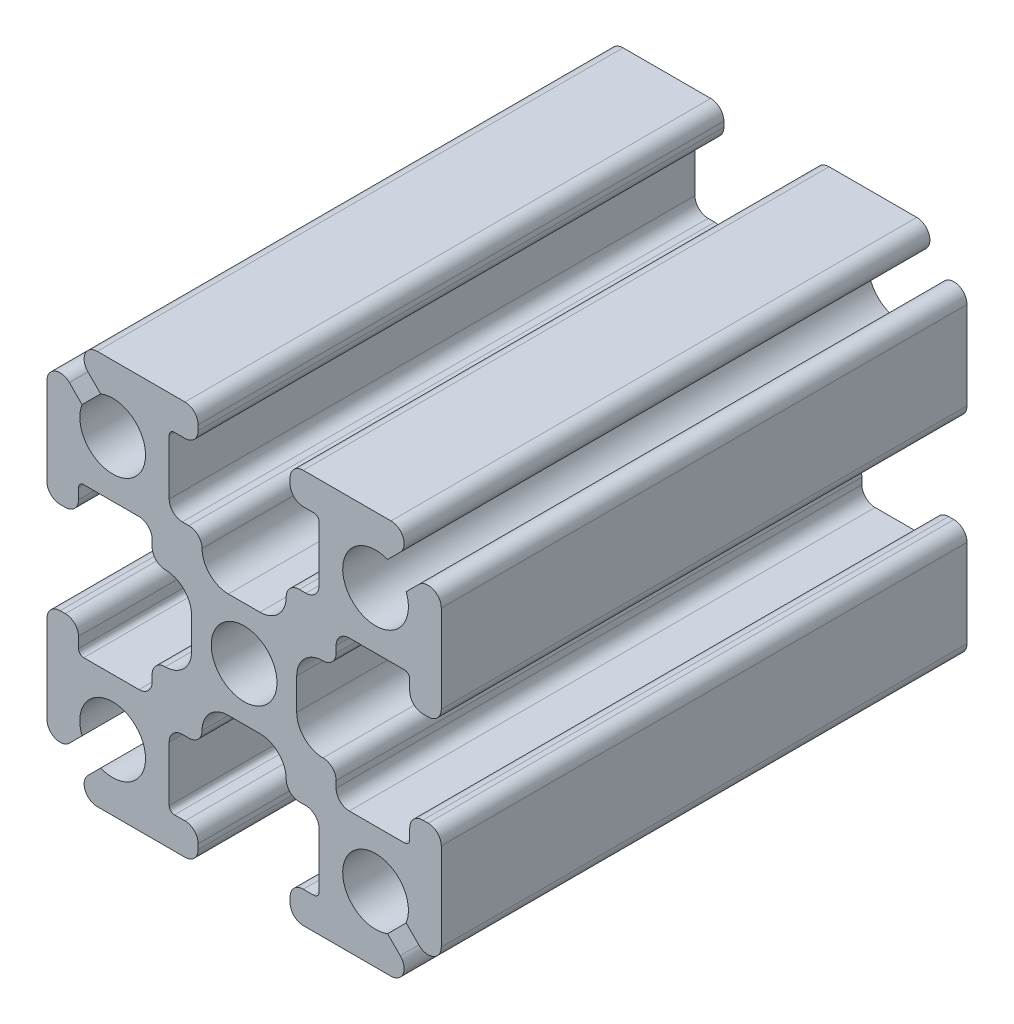
from build123d import *

# Parameters (mm, degrees)
SKETCH1_R           = 1.25
BOSS_EXTRUDE1_DEPTH = 20


with BuildPart() as part:
    # Sketch1 → Boss-Extrude1 (new body)
    with BuildSketch(Plane.XY):
        with BuildLine():
            Line((6.646446609, 5.939339828), (6.163645978, 5.456539197))
            ThreePointArc((6.163645978, 5.456539197), (4.116116524, 4.116116524), (5.456539197, 6.163645978))
            Line((5.456539197, 6.163645978), (5.939339828, 6.646446609))
            ThreePointArc((5.939339828, 6.646446609), (6.047726204, 7.191341716), (5.585786438, 7.5))
            Line((5.585786438, 7.5), (2.25, 7.5))
            ThreePointArc((2.25, 7.5), (1.896446609, 7.353553391), (1.75, 7))
            Line((1.75, 7), (1.75, 6.8))
            ThreePointArc((1.75, 6.8), (1.896446609, 6.446446609), (2.25, 6.3))
            Line((2.25, 6.3), (2.65, 6.3))
            ThreePointArc((2.65, 6.3), (2.791421356, 6.241421356), (2.85, 6.1))
            Line((2.85, 6.1), (2.85, 4))
            ThreePointArc((2.85, 4), (2.703553391, 3.646446609), (2.35, 3.5))
            Line((2.35, 3.5), (2.1, 3.5))
            ThreePointArc((2.1, 3.5), (1.746446609, 3.353553391), (1.6, 3))
            ThreePointArc((1.6, 3), (1.307106781, 2.292893219), (0.6, 2))
            Line((0.6, 2), (-0.6, 2))
            ThreePointArc((-0.6, 2), (-1.307106781, 2.292893219), (-1.6, 3))
            ThreePointArc((-1.6, 3), (-1.746446609, 3.353553391), (-2.1, 3.5))
            Line((-2.1, 3.5), (-2.35, 3.5))
            ThreePointArc((-2.35, 3.5), (-2.703553391, 3.646446609), (-2.85, 4))
            Line((-2.85, 4), (-2.85, 6.1))
            ThreePointArc((-2.85, 6.1), (-2.791421356, 6.241421356), (-2.65, 6.3))
            Line((-2.65, 6.3), (-2.25, 6.3))
            ThreePointArc((-2.25, 6.3), (-1.896446609, 6.446446609), (-1.75, 6.8))
            Line((-1.75, 6.8), (-1.75, 7))
            ThreePointArc((-1.75, 7), (-1.896446609, 7.353553391), (-2.25, 7.5))
            Line((-2.25, 7.5), (-5.585786438, 7.5))
            ThreePointArc((-5.585786438, 7.5), (-6.047726204, 7.191341716), (-5.939339828, 6.646446609))
            Line((-5.939339828, 6.646446609), (-5.456539197, 6.163645978))
            ThreePointArc((-5.456539197, 6.163645978), (-4.116116524, 4.116116524), (-6.163645978, 5.456539197))
            Line((-6.163645978, 5.456539197), (-6.646446609, 5.939339828))
            ThreePointArc((-6.646446609, 5.939339828), (-7.191341716, 6.047726204), (-7.5, 5.585786438))
            Line((-7.5, 5.585786438), (-7.5, 2.25))
            ThreePointArc((-7.5, 2.25), (-7.353553391, 1.896446609), (-7, 1.75))
            Line((-7, 1.75), (-6.8, 1.75))
            ThreePointArc((-6.8, 1.75), (-6.446446609, 1.896446609), (-6.3, 2.25))
            Line((-6.3, 2.25), (-6.3, 2.65))
            ThreePointArc((-6.3, 2.65), (-6.241421356, 2.791421356), (-6.1, 2.85))
            Line((-6.1, 2.85), (-4, 2.85))
            ThreePointArc((-4, 2.85), (-3.646446609, 2.703553391), (-3.5, 2.35))
            Line((-3.5, 2.35), (-3.5, 2.1))
            ThreePointArc((-3.5, 2.1), (-3.353553391, 1.746446609), (-3, 1.6))
            ThreePointArc((-3, 1.6), (-2.292893219, 1.307106781), (-2, 0.6))
            Line((-2, 0.6), (-2, -0.6))
            ThreePointArc((-2, -0.6), (-2.292893219, -1.307106781), (-3, -1.6))
            ThreePointArc((-3, -1.6), (-3.353553391, -1.746446609), (-3.5, -2.1))
            Line((-3.5, -2.1), (-3.5, -2.35))
            ThreePointArc((-3.5, -2.35), (-3.646446609, -2.703553391), (-4, -2.85))
            Line((-4, -2.85), (-6.1, -2.85))
            ThreePointArc((-6.1, -2.85), (-6.241421356, -2.791421356), (-6.3, -2.65))
            Line((-6.3, -2.65), (-6.3, -2.25))
            ThreePointArc((-6.3, -2.25), (-6.446446609, -1.896446609), (-6.8, -1.75))
            Line((-6.8, -1.75), (-7, -1.75))
            ThreePointArc((-7, -1.75), (-7.353553391, -1.896446609), (-7.5, -2.25))
            Line((-7.5, -2.25), (-7.5, -5.585786438))
            ThreePointArc((-7.5, -5.585786438), (-7.191341716, -6.047726204), (-6.646446609, -5.939339828))
            Line((-6.646446609, -5.939339828), (-6.163645978, -5.456539197))
            ThreePointArc((-6.163645978, -5.456539197), (-4.116116524, -4.116116524), (-5.456539197, -6.163645978))
            Line((-5.456539197, -6.163645978), (-5.939339828, -6.646446609))
            ThreePointArc((-5.939339828, -6.646446609), (-6.047726204, -7.191341716), (-5.585786438, -7.5))
            Line((-5.585786438, -7.5), (-2.25, -7.5))
            ThreePointArc((-2.25, -7.5), (-1.896446609, -7.353553391), (-1.75, -7))
            Line((-1.75, -7), (-1.75, -6.8))
            ThreePointArc((-1.75, -6.8), (-1.896446609, -6.446446609), (-2.25, -6.3))
            Line((-2.25, -6.3), (-2.65, -6.3))
            ThreePointArc((-2.65, -6.3), (-2.791421356, -6.241421356), (-2.85, -6.1))
            Line((-2.85, -6.1), (-2.85, -4))
            ThreePointArc((-2.85, -4), (-2.703553391, -3.646446609), (-2.35, -3.5))
            Line((-2.35, -3.5), (-2.1, -3.5))
            ThreePointArc((-2.1, -3.5), (-1.746446609, -3.353553391), (-1.6, -3))
            ThreePointArc((-1.6, -3), (-1.307106781, -2.292893219), (-0.6, -2))
            Line((-0.6, -2), (0.6, -2))
            ThreePointArc((0.6, -2), (1.307106781, -2.292893219), (1.6, -3))
            ThreePointArc((1.6, -3), (1.746446609, -3.353553391), (2.1, -3.5))
            Line((2.1, -3.5), (2.35, -3.5))
            ThreePointArc((2.35, -3.5), (2.703553391, -3.646446609), (2.85, -4))
            Line((2.85, -4), (2.85, -6.1))
            ThreePointArc((2.85, -6.1), (2.791421356, -6.241421356), (2.65, -6.3))
            Line((2.65, -6.3), (2.25, -6.3))
            ThreePointArc((2.25, -6.3), (1.896446609, -6.446446609), (1.75, -6.8))
            Line((1.75, -6.8), (1.75, -7))
            ThreePointArc((1.75, -7), (1.896446609, -7.353553391), (2.25, -7.5))
            Line((2.25, -7.5), (5.585786438, -7.5))
            ThreePointArc((5.585786438, -7.5), (6.047726204, -7.191341716), (5.939339828, -6.646446609))
            Line((5.939339828, -6.646446609), (5.456539197, -6.163645978))
            ThreePointArc((5.456539197, -6.163645978), (4.116116524, -4.116116524), (6.163645978, -5.456539197))
            Line((6.163645978, -5.456539197), (6.646446609, -5.939339828))
            ThreePointArc((6.646446609, -5.939339828), (7.191341716, -6.047726204), (7.5, -5.585786438))
            Line((7.5, -5.585786438), (7.5, -2.25))
            ThreePointArc((7.5, -2.25), (7.353553391, -1.896446609), (7, -1.75))
            Line((7, -1.75), (6.8, -1.75))
            ThreePointArc((6.8, -1.75), (6.446446609, -1.896446609), (6.3, -2.25))
            Line((6.3, -2.25), (6.3, -2.65))
            ThreePointArc((6.3, -2.65), (6.241421356, -2.791421356), (6.1, -2.85))
            Line((6.1, -2.85), (4, -2.85))
            ThreePointArc((4, -2.85), (3.646446609, -2.703553391), (3.5, -2.35))
            Line((3.5, -2.35), (3.5, -2.1))
            ThreePointArc((3.5, -2.1), (3.353553391, -1.746446609), (3, -1.6))
            ThreePointArc((3, -1.6), (2.292893219, -1.307106781), (2, -0.6))
            Line((2, -0.6), (2, 0.6))
            ThreePointArc((2, 0.6), (2.292893219, 1.307106781), (3, 1.6))
            ThreePointArc((3, 1.6), (3.353553391, 1.746446609), (3.5, 2.1))
            Line((3.5, 2.1), (3.5, 2.35))
            ThreePointArc((3.5, 2.35), (3.646446609, 2.703553391), (4, 2.85))
            Line((4, 2.85), (6.1, 2.85))
            ThreePointArc((6.1, 2.85), (6.241421356, 2.791421356), (6.3, 2.65))
            Line((6.3, 2.65), (6.3, 2.25))
            ThreePointArc((6.3, 2.25), (6.446446609, 1.896446609), (6.8, 1.75))
            Line((6.8, 1.75), (7, 1.75))
            ThreePointArc((7, 1.75), (7.353553391, 1.896446609), (7.5, 2.25))
            Line((7.5, 2.25), (7.5, 5.585786438))
            ThreePointArc((7.5, 5.585786438), (7.191341716, 6.047726204), (6.646446609, 5.939339828))
        make_face()
        with Locations(Location((0, 0, 0), (0, 0, 180))):
            Circle(SKETCH1_R, mode=Mode.SUBTRACT)
    extrude(amount=BOSS_EXTRUDE1_DEPTH)


solid = part.part
